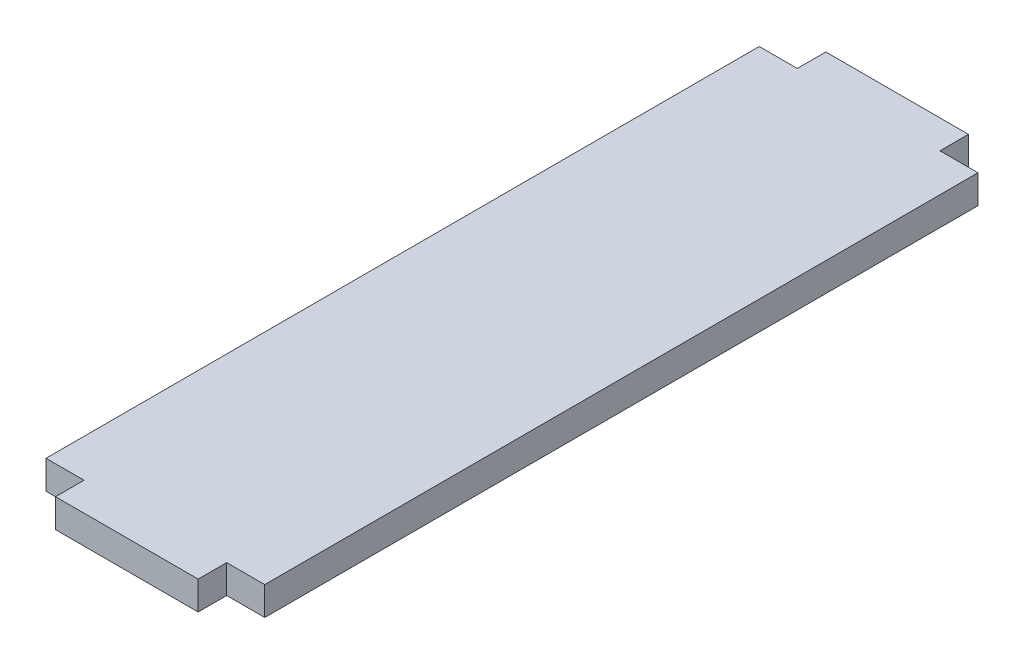
from build123d import *

# Parameters (mm, degrees)
BOSS_EXTRUDE1_DEPTH = 1.5


with BuildPart() as part:
    # Sketch1 → Boss-Extrude1 (new body)
    with BuildSketch(Plane(origin=(0, 0, 0), x_dir=(1, 0, 0), z_dir=(0, 1, 0))):
        Polygon((3.75, 18.75), (5.75, 18.75), (5.75, -18.75), (3.75, -18.75), (3.75, -20.25), (-3.75, -20.25), (-3.75, -18.75), (-5.75, -18.75), (-5.75, 18.75), (-3.75, 18.75), (-3.75, 20.25), (3.75, 20.25), align=None)
    extrude(amount=BOSS_EXTRUDE1_DEPTH)


solid = part.part
